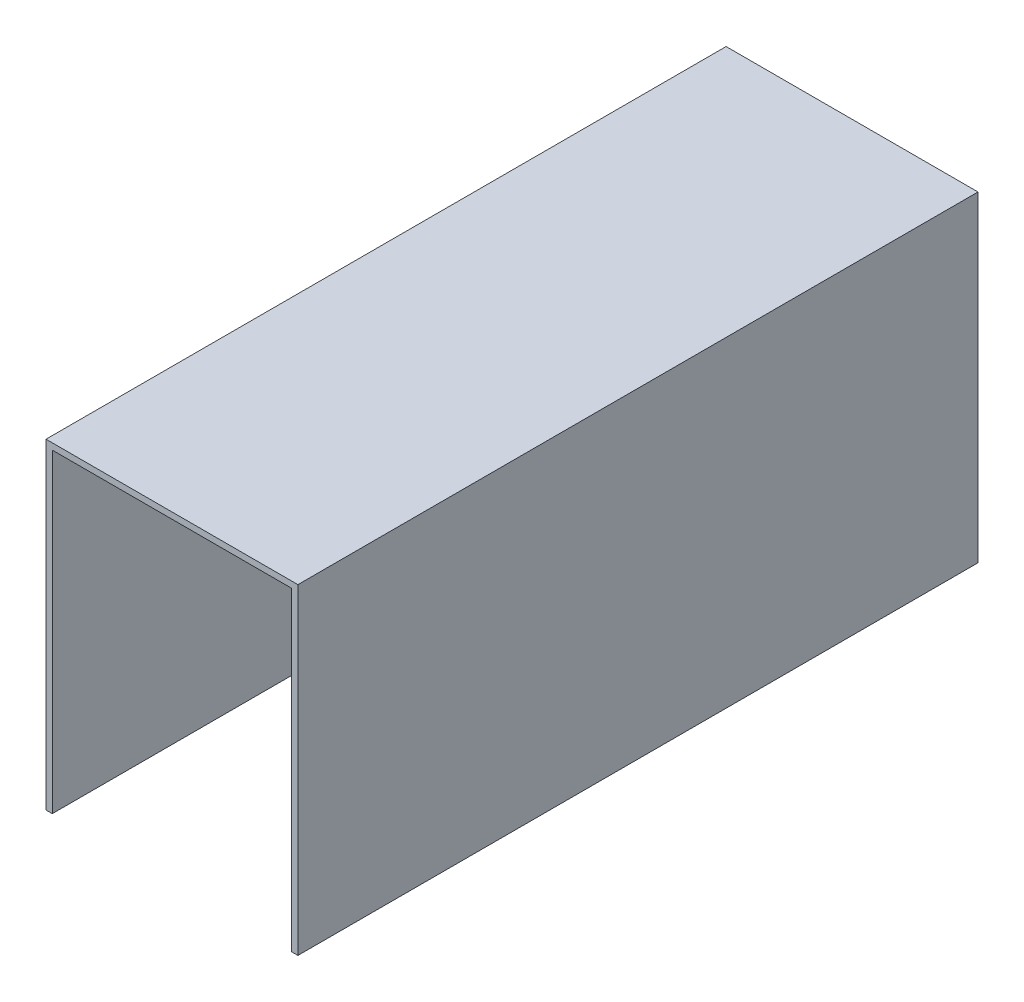
from build123d import *

# Parameters (mm, degrees)
RESSALTO_EXTRUS_O1_DEPTH = 108


with BuildPart() as part:
    # Esboço1 → Ressalto-extrusão1 (new body)
    with BuildSketch(Plane.XY):
        Polygon((-7.336275026, 0), (-7.336275026, 50), (30.663724974, 50), (30.663724974, 0), (31.663724974, 0), (31.663724974, 51), (-8.336275026, 51), (-8.336275026, 0), align=None)
    extrude(amount=RESSALTO_EXTRUS_O1_DEPTH)


solid = part.part
